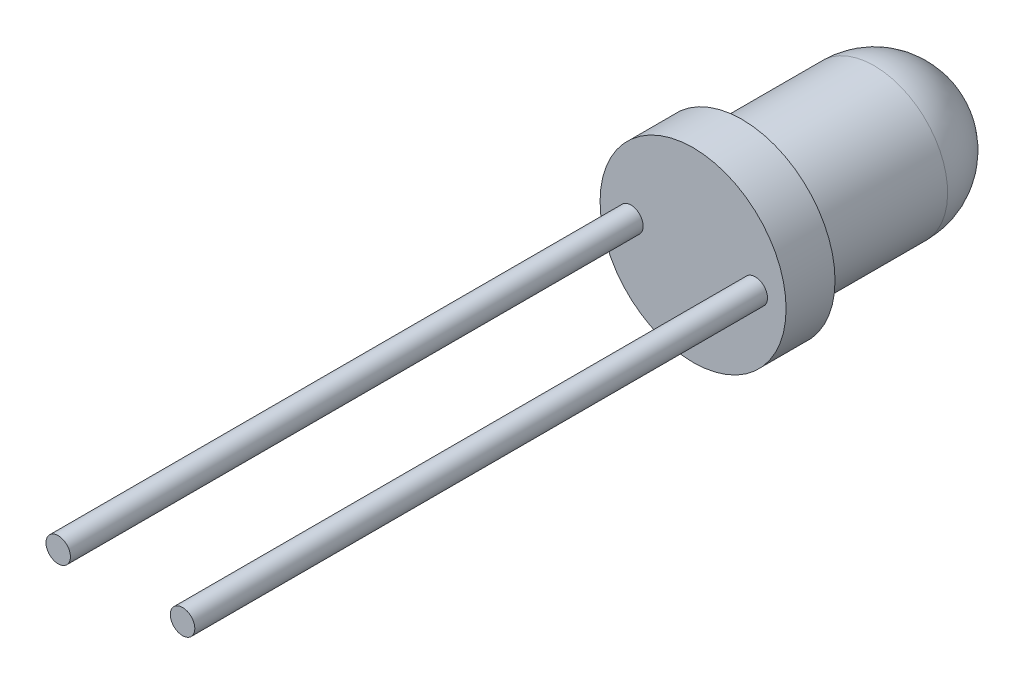
from build123d import *

# Parameters (mm, degrees)
SKETCH_1_R      = 1.5
EXTRUDE_1_DEPTH = 3.7
SKETCH_2_R      = 1.9
EXTRUDE_2_DEPTH = 1
SKETCH_3_R      = 0.25
EXTRUDE_3_DEPTH = 12.7


with BuildPart() as part:
    # 草图1 → 拉伸1 (new body)
    with BuildSketch(Plane.XY):
        Circle(SKETCH_1_R)
    extrude(amount=EXTRUDE_1_DEPTH)

    # 草图2 → 拉伸2 (add)
    with BuildSketch(Plane.XY.offset(3.7)):
        Circle(SKETCH_2_R)
    extrude(amount=-EXTRUDE_2_DEPTH)

    # 草图3 → 拉伸3 (add)
    with BuildSketch(Plane(origin=(0, 0, 2.7), x_dir=(-1, 0, 0), z_dir=(0, 0, -1))):
        with Locations((-1.27, 0)):
            Circle(SKETCH_3_R)
        with Locations(Location((1.27, 0, 0), (0, 0, 180))):
            Circle(SKETCH_3_R)
    extrude(amount=-EXTRUDE_3_DEPTH)

    # 草图5 → 旋转2 (revolve)
    with BuildSketch(Plane(origin=(0, 0, 0), x_dir=(0, 0, -1), z_dir=(1, 0, 0))):
        with BuildLine():
            Line((0, 1.5), (0, 0))
            Line((0, 0), (1.5, 0))
            ThreePointArc((1.5, 0), (1.060660172, 1.060660172), (0, 1.5))
        make_face()
    revolve(axis=Axis((0, 0, -1.5), (0, 0, 1)))


solid = part.part
